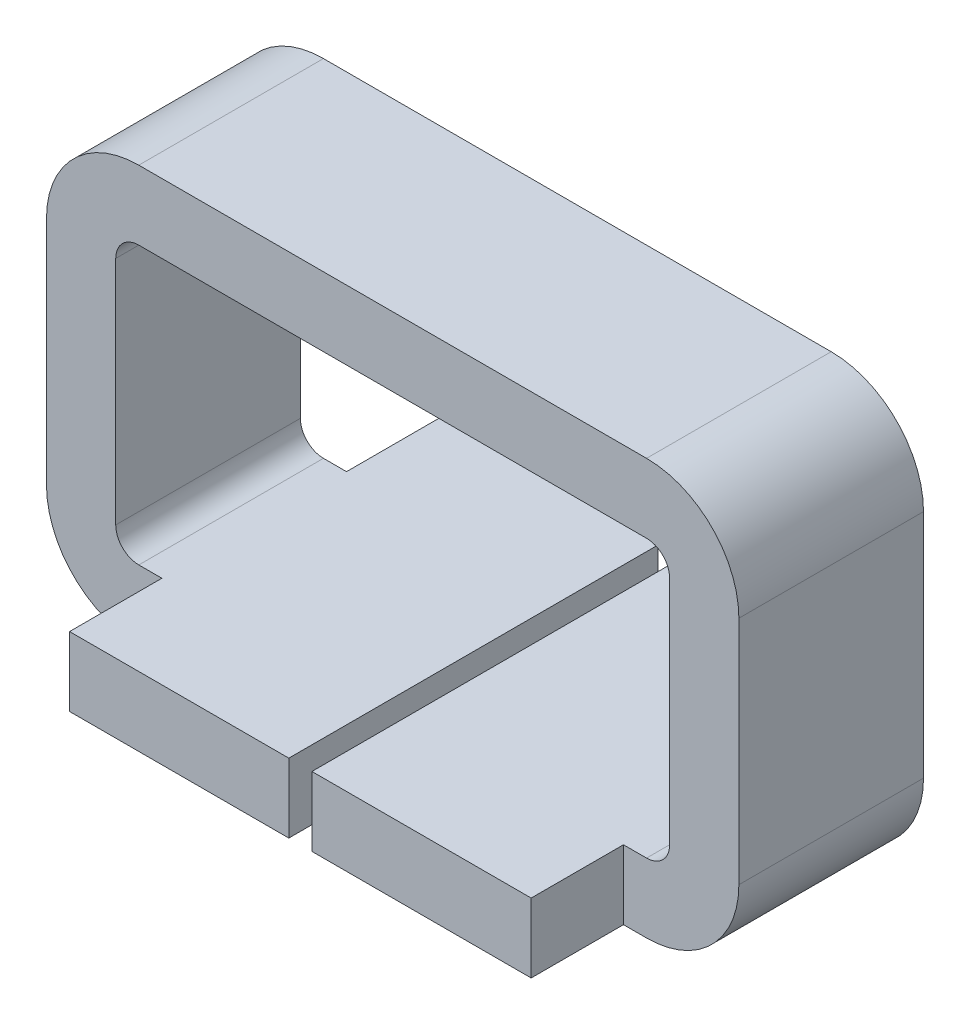
from build123d import *

# Parameters (mm, degrees)
BOSS_EXTRUDE1_DEPTH      = 0.508
BOSS_EXTRUDE1_DEPTH_BACK = 0.508
SKETCH2_W                = 2.54
SKETCH2_H                = 2.032
BOSS_EXTRUDE2_DEPTH      = 0.381
SKETCH3_W                = 0.127
SKETCH3_H                = 2.032
CUT_EXTRUDE1_DEPTH       = 0.508


with BuildPart() as part:
    # Sketch1 → Boss-Extrude1 (new, two sides: drawn at the far end of the back side and taken through both)
    with BuildSketch(Plane.XY.offset(-BOSS_EXTRUDE1_DEPTH_BACK)):
        with BuildLine():
            Line((-1.397, 2.286), (1.397, 2.286))
            ThreePointArc((1.397, 2.286), (1.756210245, 2.137210245), (1.905, 1.778))
            Line((1.905, 1.778), (1.905, 0.508))
            ThreePointArc((1.905, 0.508), (1.756210245, 0.148789755), (1.397, 0))
            Line((1.397, 0), (-1.397, 0))
            ThreePointArc((-1.397, 0), (-1.756210245, 0.148789755), (-1.905, 0.508))
            Line((-1.905, 0.508), (-1.905, 1.778))
            ThreePointArc((-1.905, 1.778), (-1.756210245, 2.137210245), (-1.397, 2.286))
        make_face()
        with BuildLine():
            Line((-1.397, 1.905), (1.397, 1.905))
            ThreePointArc((1.397, 1.905), (1.486802561, 1.867802561), (1.524, 1.778))
            Line((1.524, 1.778), (1.524, 0.508))
            ThreePointArc((1.524, 0.508), (1.486802561, 0.418197439), (1.397, 0.381))
            Line((1.397, 0.381), (-1.397, 0.381))
            ThreePointArc((-1.397, 0.381), (-1.486802561, 0.418197439), (-1.524, 0.508))
            Line((-1.524, 0.508), (-1.524, 1.778))
            ThreePointArc((-1.524, 1.778), (-1.486802561, 1.867802561), (-1.397, 1.905))
        make_face(mode=Mode.SUBTRACT)
    extrude(amount=BOSS_EXTRUDE1_DEPTH + BOSS_EXTRUDE1_DEPTH_BACK)

    # Sketch2 → Boss-Extrude2 (add)
    with BuildSketch(Plane.XZ):
        Rectangle(SKETCH2_W, SKETCH2_H)
    extrude(amount=-BOSS_EXTRUDE2_DEPTH)

    # Sketch3 → Cut-Extrude1 (cut)
    with BuildSketch(Plane.XZ):
        Rectangle(SKETCH3_W, SKETCH3_H)
    extrude(amount=-CUT_EXTRUDE1_DEPTH, mode=Mode.SUBTRACT)


solid = part.part
